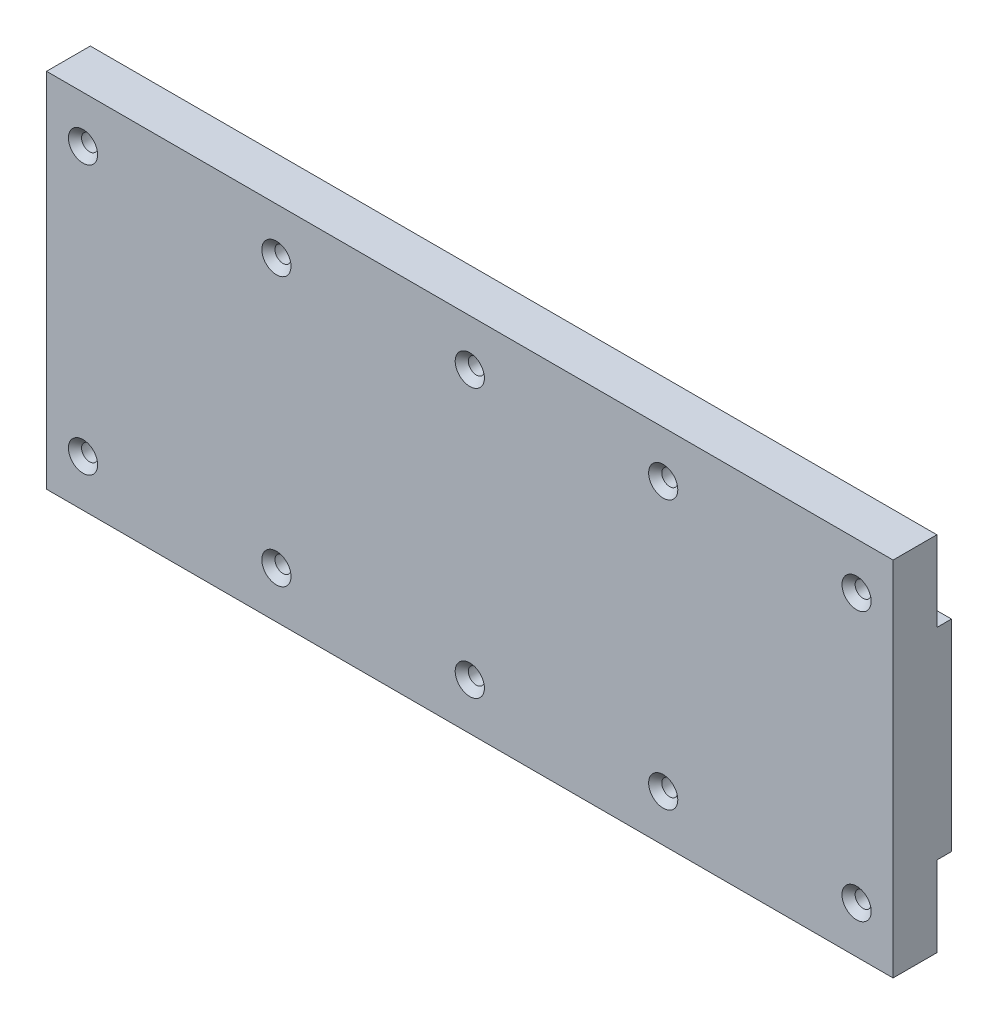
from build123d import *

# Parameters (mm, degrees)
EXTRUDE_1_DEPTH           = 290
EXTRUDE_1_DEPTH_BACK      = 290
HOLE_WIZARD_1_D           = 11
HOLE_WIZARD_1_CSINK_D     = 20
HOLE_WIZARD_1_CSINK_ANGLE = 90
PATTERN_LINEAR_1_COUNT    = 5
PATTERN_LINEAR_1_PITCH    = 132.5


with BuildPart() as part:
    # 草圖1 → 擠出1 (new, two sides: drawn at the far end of the back side and taken through both)
    with BuildSketch(Plane.YZ.offset(-EXTRUDE_1_DEPTH_BACK)):
        Polygon((69, -40), (69, -30), (124, -30), (124, 0), (-124, 0), (-124, -30), (-69, -30), (-69, -40), align=None)
    extrude(amount=EXTRUDE_1_DEPTH + EXTRUDE_1_DEPTH_BACK)

    # 孔1 (through all)
    with Locations(Plane.XY):
        with Locations((-265, 92), (-265, -92)):
            hole_wizard_1 = CounterSinkHole(HOLE_WIZARD_1_D / 2, HOLE_WIZARD_1_CSINK_D / 2, counter_sink_angle=HOLE_WIZARD_1_CSINK_ANGLE)

    # 矩形陣列1: 孔1 ×5
    with Locations(*[(i * PATTERN_LINEAR_1_PITCH, 0, 0) for i in range(1, PATTERN_LINEAR_1_COUNT)]):
        add(hole_wizard_1, mode=Mode.SUBTRACT)


solid = part.part
